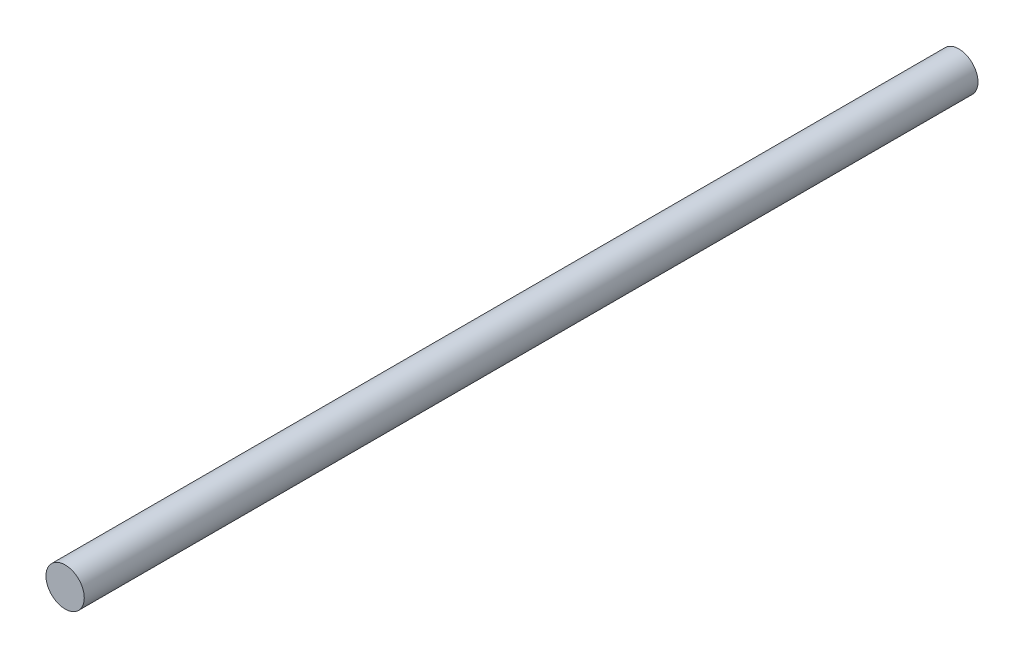
from build123d import *

# Parameters (mm, degrees)
SKETCH1_R           = 7.5
BOSS_EXTRUDE1_DEPTH = 350


with BuildPart() as part:
    # Sketch1 → Boss-Extrude1 (new body)
    with BuildSketch(Plane.XY):
        Circle(SKETCH1_R)
    extrude(amount=BOSS_EXTRUDE1_DEPTH)


solid = part.part
